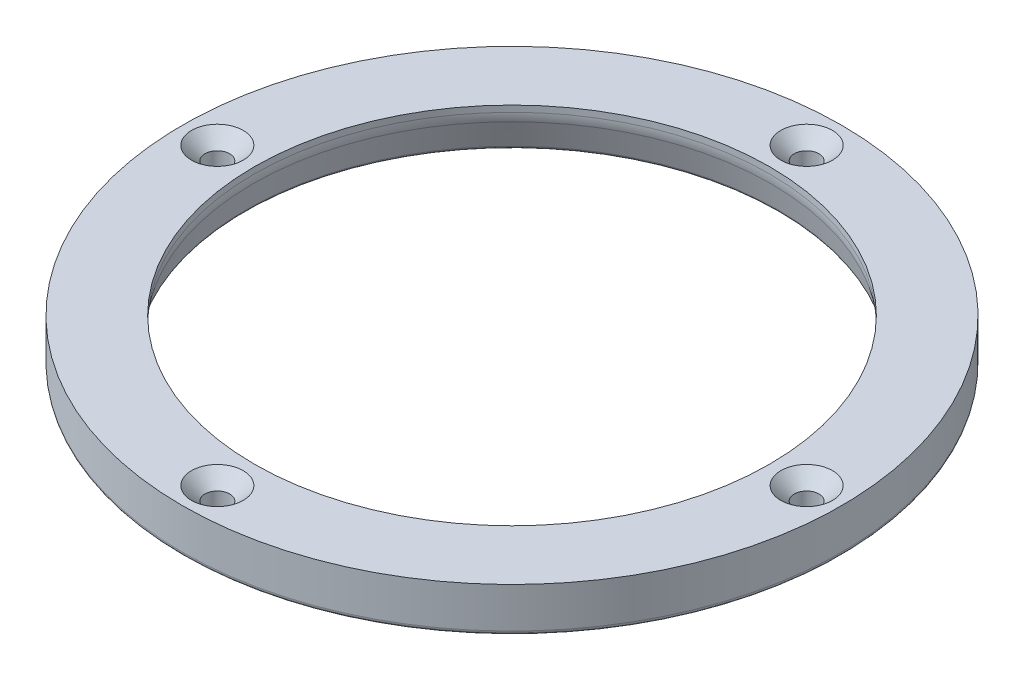
from build123d import *

# Parameters (mm, degrees)
SKETCH1_R                                       = 59.944
SKETCH1_R_2                                     = 47.244
BOSS_EXTRUDE1_DEPTH                             = 8.128
CSK_FOR_M4_FLAT_HEAD_MACHINE_SCREW1_D           = 4.5
CSK_FOR_M4_FLAT_HEAD_MACHINE_SCREW1_CSINK_D     = 9.4
CSK_FOR_M4_FLAT_HEAD_MACHINE_SCREW1_CSINK_ANGLE = 90
CIRPATTERN1_COUNT                               = 4
DRAFT2_ANGLE                                    = 15
SKETCH5_R                                       = 46.865275631
CUT_EXTRUDE1_DEPTH                              = 86.162378173
FILLET1_R                                       = 6.35
FILLET2_R                                       = 0.79375


with BuildPart() as part:
    # Sketch1 → Boss-Extrude1 (new body)
    with BuildSketch(Plane(origin=(0, 0, 0), x_dir=(1, 0, 0), z_dir=(0, 1, 0))):
        with Locations(Location((0, 0, 0), (0, 0, 270))):
            Circle(SKETCH1_R)
        with Locations(Location((0, 0, 0), (0, 0, 270))):
            Circle(SKETCH1_R_2, mode=Mode.SUBTRACT)
    extrude(amount=BOSS_EXTRUDE1_DEPTH)

    # CSK for M4 Flat Head Machine Screw1 (through all)
    with Locations(Plane(origin=(0, 8.128, -53.594), x_dir=(0, 0, 1), z_dir=(0, 1, 0))):
        with Locations((0, 0)):
            csk_for_m4_flat_head_machine_screw1 = CounterSinkHole(CSK_FOR_M4_FLAT_HEAD_MACHINE_SCREW1_D / 2, CSK_FOR_M4_FLAT_HEAD_MACHINE_SCREW1_CSINK_D / 2, counter_sink_angle=CSK_FOR_M4_FLAT_HEAD_MACHINE_SCREW1_CSINK_ANGLE)

    # CirPattern1: CSK for M4 Flat Head Machine Screw1 ×4 about axis
    cirpattern1_axis = Axis((0, 0, 0), (0, 1, 0))
    for i in range(1, CIRPATTERN1_COUNT):
        add(csk_for_m4_flat_head_machine_screw1.rotate(cirpattern1_axis, i * 360 / CIRPATTERN1_COUNT), mode=Mode.SUBTRACT)

    # Draft2
    draft2_faces = [part.faces().sort_by_distance(p)[0] for p in [
        (0, 4.064, -47.244),
    ]]
    draft(draft2_faces, Plane(origin=(0, 0, 0), x_dir=(0, 0, -1), z_dir=(0, -1, 0)), DRAFT2_ANGLE)

    # Sketch4 → Cut-Revolve1 (revolve, cut)
    with BuildSketch(Plane(origin=(0, 0, 0), x_dir=(0, 0, -1), z_dir=(1, 0, 0)), mode=Mode.PRIVATE) as cut_revolve1_sk:
        Polygon((47.244, 0), (45.066108964, 8.128), (46.336108964, 8.128), (48.514, 0), align=None)
    revolve(cut_revolve1_sk.sketch.rotate(Axis((0, 8.128, 0), (0, -1, 0)), 180), axis=Axis((0, 8.128, 0), (0, -1, 0)), mode=Mode.SUBTRACT)

    # Sketch5 → Cut-Extrude1 (cut, through all)
    with BuildSketch(Plane(origin=(0, 8.128, 0), x_dir=(1, 0, 0), z_dir=(0, 1, 0))):
        with Locations(Location((0, 0, 0), (0, 0, 270))):
            Circle(SKETCH5_R)
    extrude(amount=-CUT_EXTRUDE1_DEPTH, mode=Mode.SUBTRACT)

    # Fillet1
    fillet1_edges = [part.edges().sort_by_distance(p)[0] for p in [
        (0, 6.153123114, -46.865275631),
    ]]
    fillet(fillet1_edges, radius=FILLET1_R)

    # Fillet2
    fillet2_edges = [part.edges().sort_by_distance(p)[0] for p in [
        (0, 0, -59.944),
        (0, 0, -48.514),
    ]]
    fillet(fillet2_edges, radius=FILLET2_R)


solid = part.part
